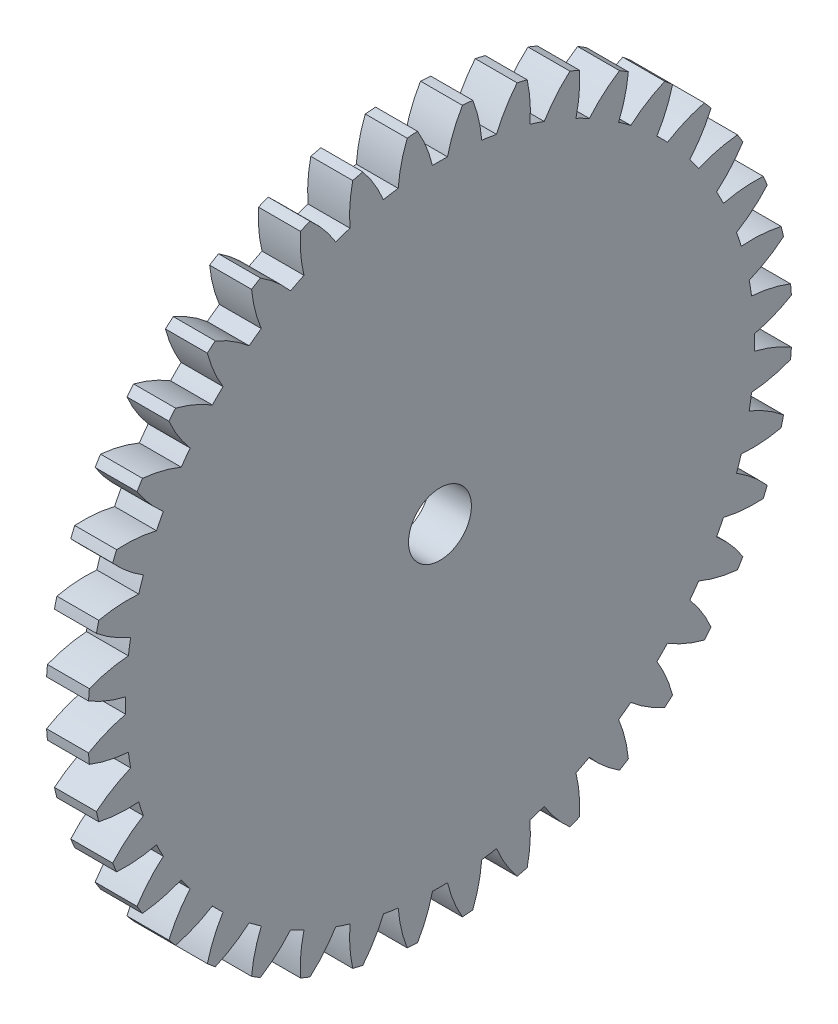
from build123d import *

# Parameters (mm, degrees)
BASPROSKE_W     = 2
BASPROSKE_H     = 16.8
TOOTHCUT_DEPTH  = 24.842818625
TEETHCUTS_COUNT = 40
TEETHCUTS_ANGLE = 351
BORSKE_R        = 1.5
BORE_DEPTH      = 50.0000508


with BuildPart() as part:
    # BasProSke → Base-Revolve (revolve)
    with BuildSketch(Plane(origin=(0, 0, 0), x_dir=(1, 0, 0), z_dir=(0, 1, 0)), mode=Mode.PRIVATE) as base_revolve_sk:
        with Locations((1, 8.4)):
            Rectangle(BASPROSKE_W, BASPROSKE_H)
    revolve(base_revolve_sk.sketch.rotate(Axis((-10, 0, 0), (1, 0, 0)), 180), axis=Axis((-10, 0, 0), (1, 0, 0)))

    # TooCutSke → ToothCut (cut, through all)
    with BuildSketch(Plane(origin=(0, 0, 0), x_dir=(0, 0, -1), z_dir=(1, 0, 0))):
        with BuildLine():
            ThreePointArc((0.358234928, 14.994721362), (0, 14.999), (-0.358234928, 14.994721362))
            ThreePointArc((-0.358234928, 14.994721362), (-0.653764873, 15.920217236), (-1.085976921, 16.790316831))
            ThreePointArc((-1.085976921, 16.790316831), (0, 16.8254), (1.085976921, 16.790316831))
            ThreePointArc((1.085976921, 16.790316831), (0.653764873, 15.920217236), (0.358234928, 14.994721362))
        make_face()
    toothcut = extrude(amount=TOOTHCUT_DEPTH, mode=Mode.SUBTRACT)

    # TeethCuts: ToothCut ×40 about axis
    teethcuts_axis = Axis((-10, 0, 0), (1, 0, 0))
    for i in range(1, TEETHCUTS_COUNT):
        add(toothcut.rotate(teethcuts_axis, i * TEETHCUTS_ANGLE / (TEETHCUTS_COUNT - 1)), mode=Mode.SUBTRACT)

    # BorSke → Bore (cut, symmetric)
    with BuildSketch(Plane(origin=(0, 0, 0), x_dir=(0, 0, -1), z_dir=(1, 0, 0))):
        with Locations(Location((0, 0, 0), (0, 0, 180))):
            Circle(BORSKE_R)
    extrude(amount=BORE_DEPTH, both=True, mode=Mode.SUBTRACT)


solid = part.part
